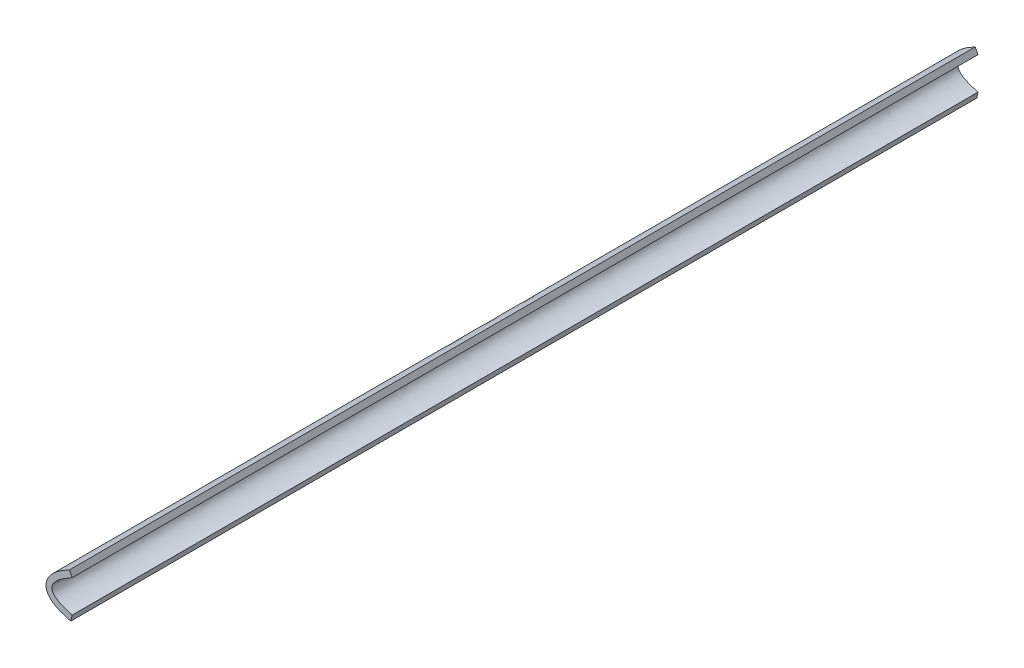
from build123d import *

# Parameters (mm, degrees)
BOSS_EXTRUDE1_DEPTH = 750


with BuildPart() as part:
    # Master sketch-Wing Geometry Master Sketc → Boss-Extrude1 (new body)
    with BuildSketch(Plane.XY):
        with BuildLine():
            Line((21.49585547, 18.154997053), (19.219088354, 22.606550883))
            add(Edge.make_bspline(
                [(19.219088354, 22.606550883), (18.91184929, 22.44941209), (17.826873119, 21.886545621), (16.018830268, 20.906450267), (13.862897373, 19.621565208), (11.854738026, 18.324267668), (9.991886559, 17.019209829), (8.29105075, 15.695648594), (6.733737603, 14.377178643), (5.333111428, 13.049907652), (4.088387896, 11.719417741), (3.000757578, 10.389377073), (2.083773717, 9.056425431), (1.296663895, 7.741902015), (0.688475961, 6.422740397), (0.23262927, 5.113019434), (-0.074116898, 3.816764785), (-0.216963809, 2.527030734), (-0.194835649, 1.250981582), (-0.081699689, 0.412720493), (1e-09, -3e-09)],
                knots=[0.459857253, 0.459857253, 0.459857253, 0.459857253, 0.461512913, 0.465721242, 0.469723075, 0.473551514, 0.477190037, 0.480632296, 0.483888395, 0.486976777, 0.489884981, 0.492625083, 0.495211517, 0.497641776, 0.499967426, 0.502167608, 0.504285812, 0.506345175, 0.508376587, 0.510394165, 0.510394165, 0.510394165, 0.510394165], degree=3))
            add(Edge.make_bspline(
                [(1e-09, -3e-09), (0.081684287, -0.412642687), (0.296437792, -1.230848824), (0.768361471, -2.417168941), (1.395039231, -3.55210015), (2.164395635, -4.637502069), (3.063933709, -5.680778391), (4.118047763, -6.661544162), (5.299534363, -7.604059656), (6.628634498, -8.491704765), (8.087985719, -9.340131837), (9.682040573, -10.139020116), (11.403068092, -10.884858395), (13.250509034, -11.589254087), (15.22698417, -12.228055044), (17.321952248, -12.8451616), (19.060832937, -13.277616891), (20.099218455, -13.517680403), (20.394317181, -13.584335848)],
                knots=[0.510394165, 0.510394165, 0.510394165, 0.510394165, 0.512411362, 0.514442775, 0.516504186, 0.518616283, 0.520815941, 0.523101374, 0.525514204, 0.52806037, 0.530762307, 0.533608996, 0.536610006, 0.539758552, 0.543091515, 0.546573597, 0.55023535, 0.551686861, 0.551686861, 0.551686861, 0.551686861], degree=3))
            Line((20.394317181, -13.584335848), (21.495939944, -8.707202746))
            add(Edge.make_bspline(
                [(21.49585547, 18.154997053), (-12.082056869, 0.079644189), (21.495939944, -8.707202746)],
                knots=[0, 0, 0, 1, 1, 1], degree=2))
        make_face()
    extrude(amount=BOSS_EXTRUDE1_DEPTH)


solid = part.part
